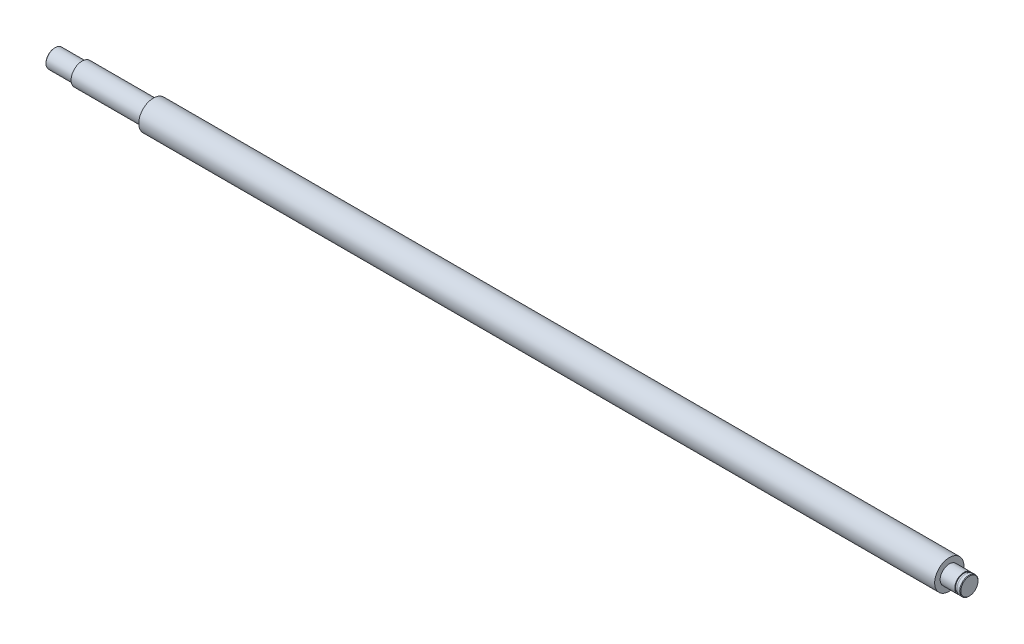
from build123d import *

# Parameters (mm, degrees)
SKETCH_2_W     = 1.15
SKETCH_2_H     = 0.4
CHAMFER_1_SIZE = 0.3


with BuildPart() as part:
    # Эскиз1 → Повернуть1 (revolve)
    with BuildSketch(Plane.XY):
        Polygon((-250, 0), (250, 0), (250, 5), (239, 5), (239, 8), (-196, 8), (-196, 6), (-235, 6), (-235, 5), (-250, 5), align=None)
    revolve(axis=Axis((-250, 0, 0), (1, 0, 0)))

    # Эскиз2 → Вырез-Повернуть1 (revolve, cut)
    with BuildSketch(Plane.XY):
        with Locations((247.575, 4.8)):
            Rectangle(SKETCH_2_W, SKETCH_2_H)
    revolve(axis=Axis((239, 0, 0), (1, 0, 0)), mode=Mode.SUBTRACT)

    # Фаска1
    chamfer_1_edges = [part.edges().sort_by_distance(p)[0] for p in [
        (-250, -5, 0),
        (250, -5, 0),
    ]]
    chamfer(chamfer_1_edges, length=CHAMFER_1_SIZE)


solid = part.part
